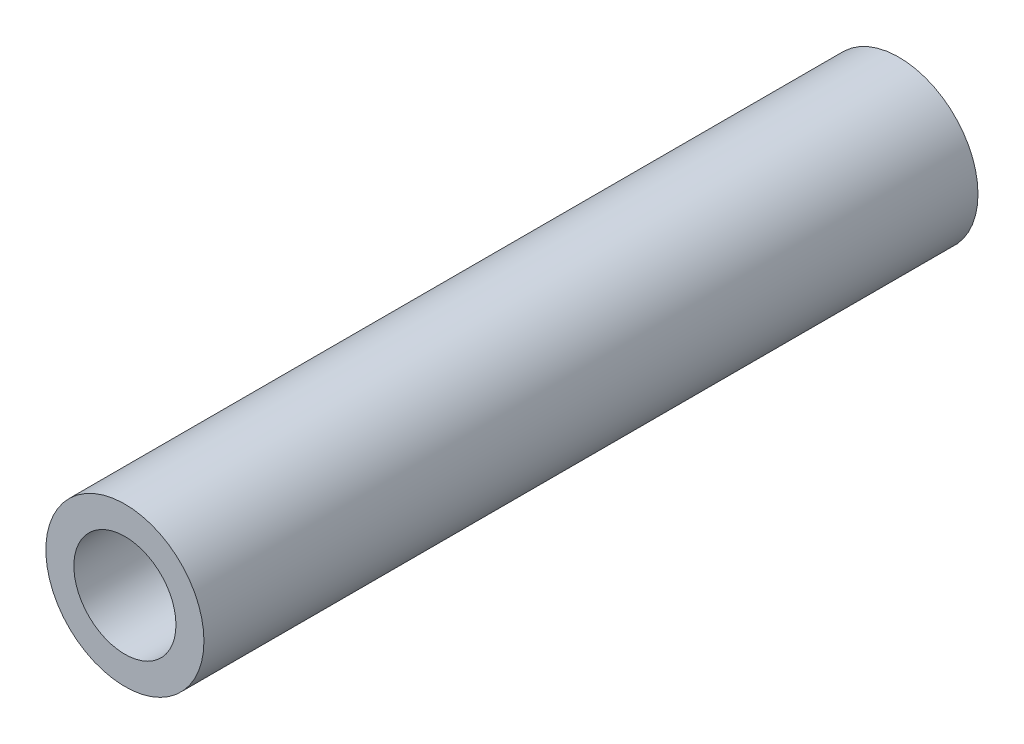
from build123d import *

# Parameters (mm, degrees)
SKETCH1_R           = 2.4
SKETCH1_R_2         = 1.55
BOSS_EXTRUDE1_DEPTH = 23.5


with BuildPart() as part:
    # Sketch1 → Boss-Extrude1 (new body)
    with BuildSketch(Plane.XY):
        Circle(SKETCH1_R)
        Circle(SKETCH1_R_2, mode=Mode.SUBTRACT)
    extrude(amount=BOSS_EXTRUDE1_DEPTH)


solid = part.part
